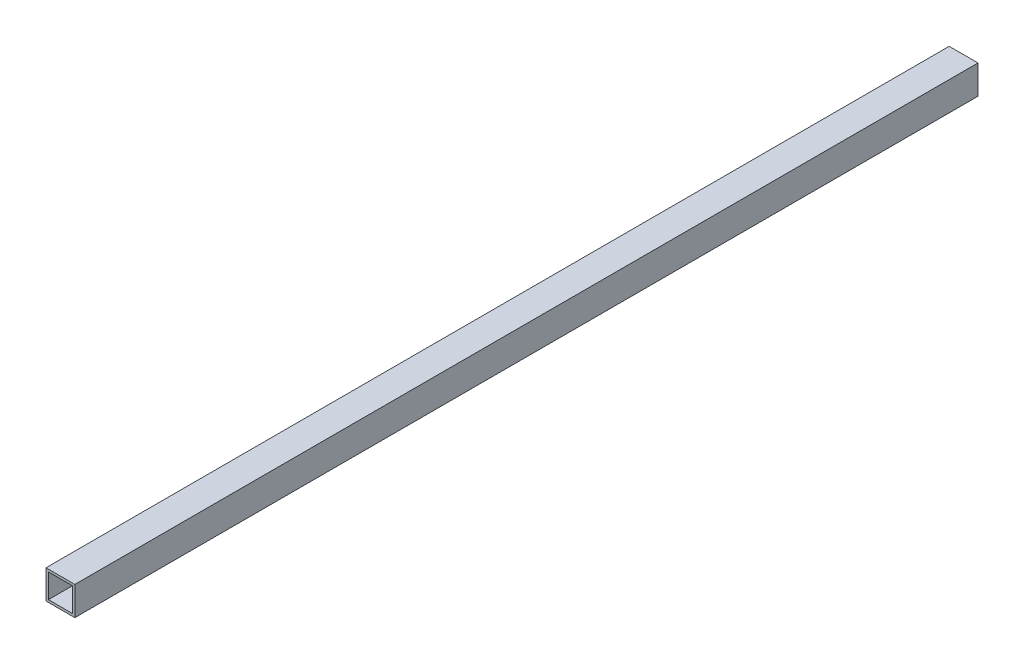
from build123d import *

# Parameters (mm, degrees)
BOSS_EXTRUDE1_DEPTH      = 596.9
BOSS_EXTRUDE1_DEPTH_BACK = 596.9
SKETCH3_W                = 38.1
SKETCH3_H                = 38.1
SKETCH3_W_2              = 31.75
SKETCH3_H_2              = 31.75


with BuildPart() as part:
    # Sketch3 → Boss-Extrude1 (new, two sides: drawn at the far end of the back side and taken through both)
    with BuildSketch(Plane.XY.offset(-BOSS_EXTRUDE1_DEPTH_BACK)):
        Rectangle(SKETCH3_W, SKETCH3_H)
        Rectangle(SKETCH3_W_2, SKETCH3_H_2, mode=Mode.SUBTRACT)
    extrude(amount=BOSS_EXTRUDE1_DEPTH + BOSS_EXTRUDE1_DEPTH_BACK)


solid = part.part
